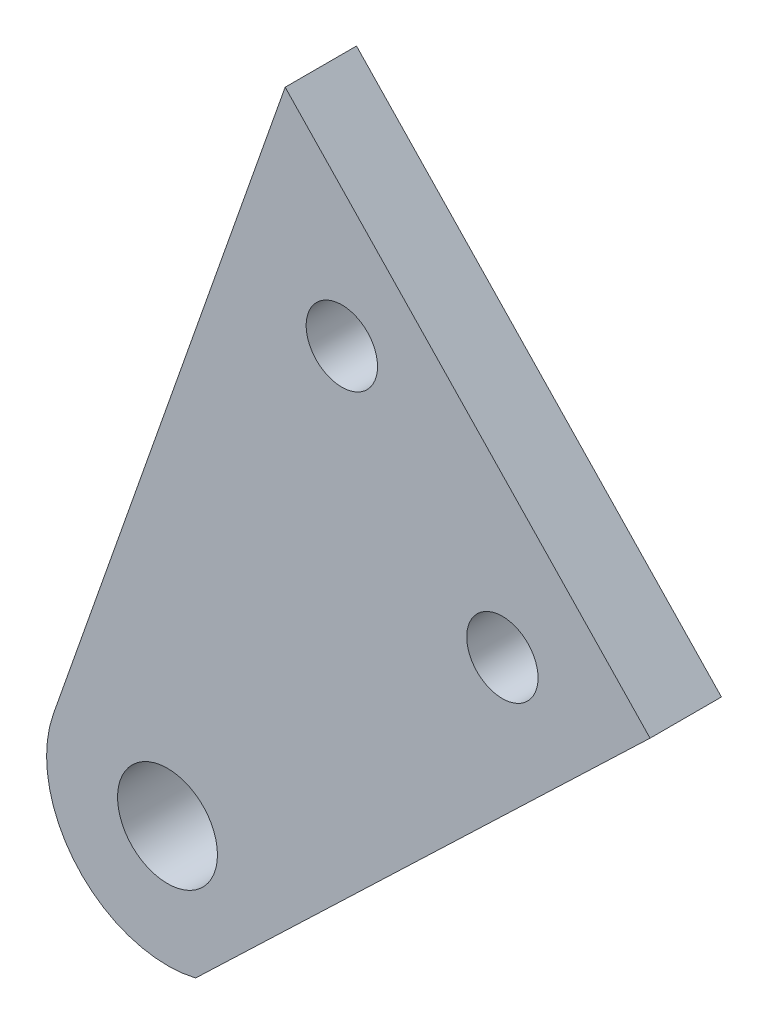
from build123d import *

# Parameters (mm, degrees)
SKETCH1_R           = 1.5
BOSS_EXTRUDE1_DEPTH = 3
SKETCH3_R           = 2.1
CUT_EXTRUDE1_DEPTH  = 5
BOSS_EXTRUDE2_START = -3
SKETCH4_R           = 2.1
SKETCH4_R_2         = 1.5
BOSS_EXTRUDE2_DEPTH = 3


with BuildPart() as part:
    # Sketch1 → Boss-Extrude1 (new body)
    with BuildSketch(Plane.XY):
        with BuildLine():
            Line((-23.846751299, 12.315625527), (-25.790964416, 1.588420048))
            ThreePointArc((-25.790964416, 1.588420048), (-23.621324023, -2.99099118), (-18.587504633, -2.408746401))
            Line((-18.587504633, -2.408746401), (-9.554934768, 5.787656918))
            Line((-9.554934768, 5.787656918), (-6.092344559, 8.929706888))
            Line((-6.092344559, 8.929706888), (-21.437418033, 24.964674832))
            Line((-21.437418033, 24.964674832), (-22.045496957, 21.772247946))
            Line((-22.045496957, 21.772247946), (-23.846751299, 12.315625527))
        make_face()
        with Locations((-19.053986742, 16.730936194)):
            Circle(SKETCH1_R, mode=Mode.SUBTRACT)
        with Locations((-12.303254046, 8.7654358)):
            Circle(SKETCH1_R, mode=Mode.SUBTRACT)
    extrude(amount=BOSS_EXTRUDE1_DEPTH)

    # Sketch3 → Cut-Extrude1 (cut)
    with BuildSketch(Plane.XY.offset(3)):
        with Locations((-21.51274635, 0.809673644)):
            Circle(SKETCH3_R)
    extrude(amount=-CUT_EXTRUDE1_DEPTH, mode=Mode.SUBTRACT)

    # Sketch4 → Boss-Extrude2 (add)
    with BuildSketch(Plane.XY.offset(3).offset(BOSS_EXTRUDE2_START)):
        with BuildLine():
            Line((-21.437418033, 24.964674832), (-6.092344559, 8.929706888))
            Line((-6.092344559, 8.929706888), (-25.203805177, -9.359495085))
            ThreePointArc((-25.203805177, -9.359495085), (-30.162494982, -7.817509351), (-31.18157458, -2.725574419))
            Line((-31.18157458, -2.725574419), (-21.437418033, 24.964674832))
        make_face()
        with Locations((-26.38487303, -4.41352639)):
            Circle(SKETCH4_R, mode=Mode.SUBTRACT)
        with Locations((-12.303254046, 8.7654358)):
            Circle(SKETCH4_R_2, mode=Mode.SUBTRACT)
        with Locations((-19.053986742, 16.730936194)):
            Circle(SKETCH4_R_2, mode=Mode.SUBTRACT)
    extrude(amount=BOSS_EXTRUDE2_DEPTH)


solid = part.part
